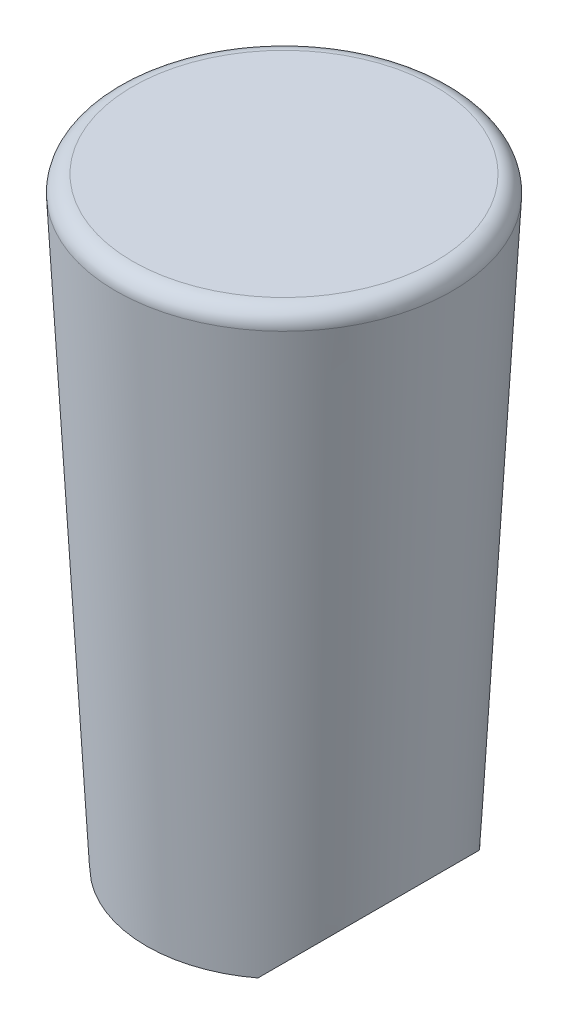
from build123d import *

# Parameters (mm, degrees)
SKETCH1_R           = 8.25
BOSS_EXTRUDE1_DEPTH = 36
BOSS_EXTRUDE1_DRAFT = -3
CUT_EXTRUDE1_DEPTH  = 3
CUT_EXTRUDE2_DEPTH  = 23
FILLET1_R           = 1


with BuildPart() as part:
    # Sketch1 → Boss-Extrude1 (with draft: the straight prism first)
    with BuildSketch(Plane(origin=(0, 0, 0), x_dir=(1, 0, 0), z_dir=(0, 1, 0))):
        Circle(SKETCH1_R)
    extrude(amount=BOSS_EXTRUDE1_DEPTH)
    # Boss-Extrude1: the draft: its side faces are tilted about the plane it starts from
    boss_extrude1_sides = [part.faces().sort_by_distance(p)[0] for p in [
        (-8.25, 18, 0),
    ]]
    draft(boss_extrude1_sides, Plane(origin=(0, 0, 0), x_dir=(1, 0, 0), z_dir=(0, 1, 0)), BOSS_EXTRUDE1_DRAFT)

    # Sketch2 → Cut-Extrude1 (cut, symmetric)
    with BuildSketch(Plane(origin=(0, 0, 0), x_dir=(0, 0, -1), z_dir=(1, 0, 0))):
        with BuildLine():
            Line((-5, 0), (5, 0))
            Line((5, 0), (5, 25))
            ThreePointArc((5, 25), (0, 30), (-5, 25))
            Line((-5, 25), (-5, 0))
        make_face()
    extrude(amount=CUT_EXTRUDE1_DEPTH, both=True, mode=Mode.SUBTRACT)

    # Sketch3 → Cut-Extrude2 (cut, symmetric)
    with BuildSketch(Plane.XY):
        Polygon((-5, 0), (5, 0), (13.833076703, 8.833076703), (13.833076703, -5.869531207), (-13.833076703, -5.869531207), (-13.833076703, 8.833076703), align=None)
    extrude(amount=CUT_EXTRUDE2_DEPTH, both=True, mode=Mode.SUBTRACT)

    # Fillet1
    fillet1_edges = [part.edges().sort_by_distance(p)[0] for p in [
        (-10.136680054, 36, 0),
    ]]
    fillet(fillet1_edges, radius=FILLET1_R)


solid = part.part
